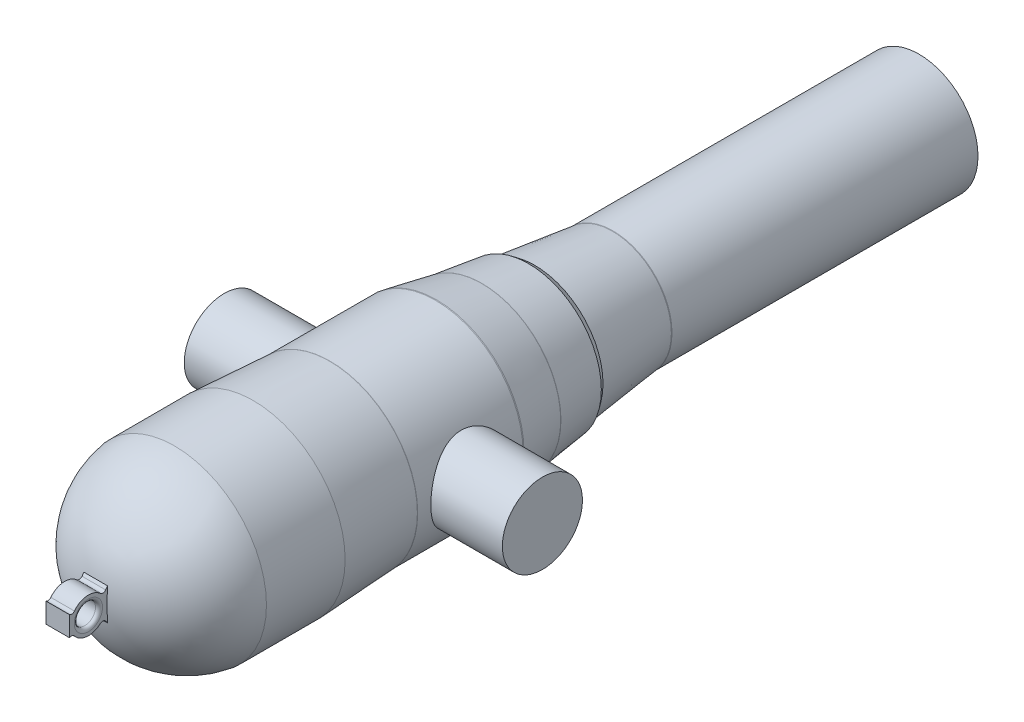
from build123d import *

# Parameters (mm, degrees)
FILLET2_R                = 0.5
BOSS_EXTRUDE1_DEPTH      = 13.5
BOSS_EXTRUDE1_DEPTH_BACK = 13.5
SKETCH4_R                = 3.4
SKETCH2_R                = 3.7
CUT_EXTRUDE3_DEPTH       = 50
BOSS_EXTRUDE4_DEPTH      = 1
BOSS_EXTRUDE4_DEPTH_BACK = 1
FILLET10_R               = 0.3
FILLET11_R               = 0.3
FILLET12_R               = 0.3


with BuildPart() as part:
    # Sketch1 → Revolve3 (revolve)
    with BuildSketch(Plane(origin=(0, 0, 0), x_dir=(0, 0, -1), z_dir=(1, 0, 0))):
        with BuildLine():
            Line((9.270955764, 5.772702061), (15.949995133, 5.772702061))
            Line((15.949995133, 5.772702061), (22.460257938, 5.405787473))
            Line((22.460257938, 5.405787473), (31.460257938, 5.405787473))
            Line((31.460257938, 5.405787473), (35.358038474, 4.669508623))
            Line((35.358038474, 4.669508623), (39.313400178, 4.15154459))
            Line((39.313400178, 4.15154459), (39.833484347, 3.774843476))
            Line((39.833484347, 3.774843476), (46.460257938, 2.972702061))
            Line((46.460257938, 2.972702061), (72.460257938, 2.972702061))
            Line((72.460257938, 2.972702061), (72.460257938, -2.027297939))
            Line((72.460257938, -2.027297939), (2.460257938, -2.027297939))
            ThreePointArc((2.460257938, -2.027297939), (4.402552529, 3.150191919), (9.270955764, 5.772702061))
        make_face()
    revolve(axis=Axis((0, -2.027297939, -2.460257938), (0, 0, -1)))

    # Fillet2
    fillet2_edges = [part.edges().sort_by_distance(p)[0] for p in [
        (0, -9.46038335, -31.460257938),
        (0, -9.46038335, -22.460257938),
        (0, -8.7241045, -35.358038474),
        (0, -7.027297939, -46.460257938),
    ]]
    fillet(fillet2_edges, radius=FILLET2_R)

    # Sketch4 → Boss-Extrude1 (add, two sides: drawn at the far end of the back side and taken through both)
    with BuildSketch(Plane(origin=(0, 0, 0), x_dir=(0, 0, -1), z_dir=(1, 0, 0)).offset(-BOSS_EXTRUDE1_DEPTH_BACK)):
        with Locations((26.990295722, -2.027297939)):
            Circle(SKETCH4_R)
    extrude(amount=BOSS_EXTRUDE1_DEPTH + BOSS_EXTRUDE1_DEPTH_BACK)

    # Sketch2 → Cut-Extrude3 (cut)
    with BuildSketch(Plane(origin=(0, 0, -72.460257938), x_dir=(-1, 0, 0), z_dir=(0, 0, -1))):
        with Locations((0, -2.027297939)):
            Circle(SKETCH2_R)
    extrude(amount=-CUT_EXTRUDE3_DEPTH, mode=Mode.SUBTRACT)

    # Sketch5 → Boss-Extrude4 (add, two sides: drawn at the far end of the back side and taken through both)
    with BuildSketch(Plane(origin=(0, 0, 0), x_dir=(0, 0, -1), z_dir=(1, 0, 0)).offset(-BOSS_EXTRUDE4_DEPTH_BACK)):
        with BuildLine():
            Line((-0.364563148, -1.323842828), (-0.639628828, -1.177788119))
            Line((-0.639628828, -1.177788119), (-0.639628828, -2.876807758))
            Line((-0.639628828, -2.876807758), (-0.364563148, -2.730753049))
            ThreePointArc((-0.364563148, -2.730753049), (0.874853819, -3.524864677), (2.196515624, -2.876807758))
            Line((2.196515624, -2.876807758), (2.579405143, -3.3917107))
            Line((2.579405143, -3.3917107), (2.579405143, -0.662885177))
            Line((2.579405143, -0.662885177), (2.196515624, -1.177788119))
            ThreePointArc((2.196515624, -1.177788119), (0.874853819, -0.5297312), (-0.364563148, -1.323842828))
        make_face()
        with BuildLine():
            ThreePointArc((1.860257938, -2.027297939), (0.960257938, -1.127297939), (0.060257938, -2.027297939))
            ThreePointArc((0.060257938, -2.027297939), (0.960257938, -2.927297939), (1.860257938, -2.027297939))
        make_face(mode=Mode.SUBTRACT)
    extrude(amount=BOSS_EXTRUDE4_DEPTH + BOSS_EXTRUDE4_DEPTH_BACK)

    # Fillet10
    fillet10_edges = [part.edges().sort_by_distance(p)[0] for p in [
        (1, -2.027297939, -1.860257938),
        (-1, -2.027297939, -1.860257938),
    ]]
    fillet(fillet10_edges, radius=FILLET10_R)

    # Fillet11
    fillet11_edges = [part.edges().sort_by_distance(p)[0] for p in [
        (0, -2.730753049, 0.364563148),
        (0, -1.323842828, 0.364563148),
    ]]
    fillet(fillet11_edges, radius=FILLET11_R)

    # Fillet12
    fillet12_edges = [part.edges().sort_by_distance(p)[0] for p in [
        (0, -2.876807758, -2.196515624),
        (0, -1.177788119, -2.196515624),
    ]]
    fillet(fillet12_edges, radius=FILLET12_R)


solid = part.part
